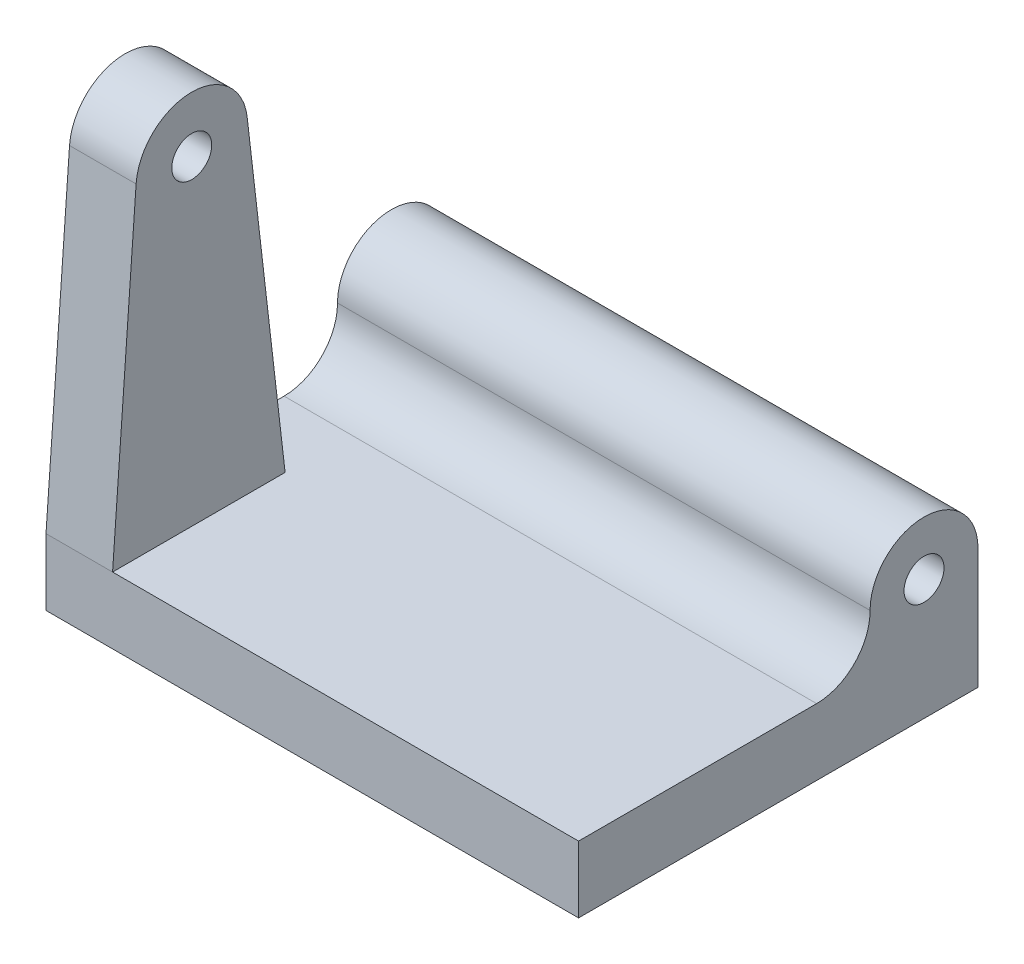
from build123d import *

# Parameters (mm, degrees)
SKETCH1_W           = 40
SKETCH1_H           = 30
BOSS_EXTRUDE1_DEPTH = 5
SKETCH2_R           = 1.5
BOSS_EXTRUDE2_DEPTH = 40
SKETCH4_R           = 1.5
BOSS_EXTRUDE4_DEPTH = 5


with BuildPart() as part:
    # Sketch1 → Boss-Extrude1 (new body)
    with BuildSketch(Plane(origin=(0, 0, 0), x_dir=(1, 0, 0), z_dir=(0, 1, 0))):
        with Locations((20, -15)):
            Rectangle(SKETCH1_W, SKETCH1_H)
    extrude(amount=BOSS_EXTRUDE1_DEPTH)

    # Sketch2 → Boss-Extrude2 (add)
    with BuildSketch(Plane.ZY):
        with BuildLine():
            ThreePointArc((8.106694093, 9.054477386), (4.053347046, 13.107824432), (0, 9.054477386))
            Line((0, 9.054477386), (0, 5))
            Line((0, 5), (12.116930909, 5))
            ThreePointArc((12.116930909, 5), (9.279911424, 6.188818307), (8.106633421, 9.032299844))
            ThreePointArc((8.106633421, 9.032299844), (8.106678925, 9.043388574), (8.106694093, 9.054477386))
        make_face()
        with Locations((4.053347046, 9.054477386)):
            Circle(SKETCH2_R, mode=Mode.SUBTRACT)
    extrude(amount=-BOSS_EXTRUDE2_DEPTH)

    # Sketch4 → Boss-Extrude4 (add)
    with BuildSketch(Plane.ZY):
        with BuildLine():
            Line((30, 5), (28.232674565, 29.357717289))
            ThreePointArc((28.232674565, 29.357717289), (24.143809842, 33.243814974), (19.891005174, 29.537843793))
            Line((19.891005174, 29.537843793), (17.041462837, 5))
            Line((17.041462837, 5), (30, 5))
        make_face()
        with Locations((24.053347046, 29.054477386)):
            Circle(SKETCH4_R, mode=Mode.SUBTRACT)
    extrude(amount=-BOSS_EXTRUDE4_DEPTH)


solid = part.part
